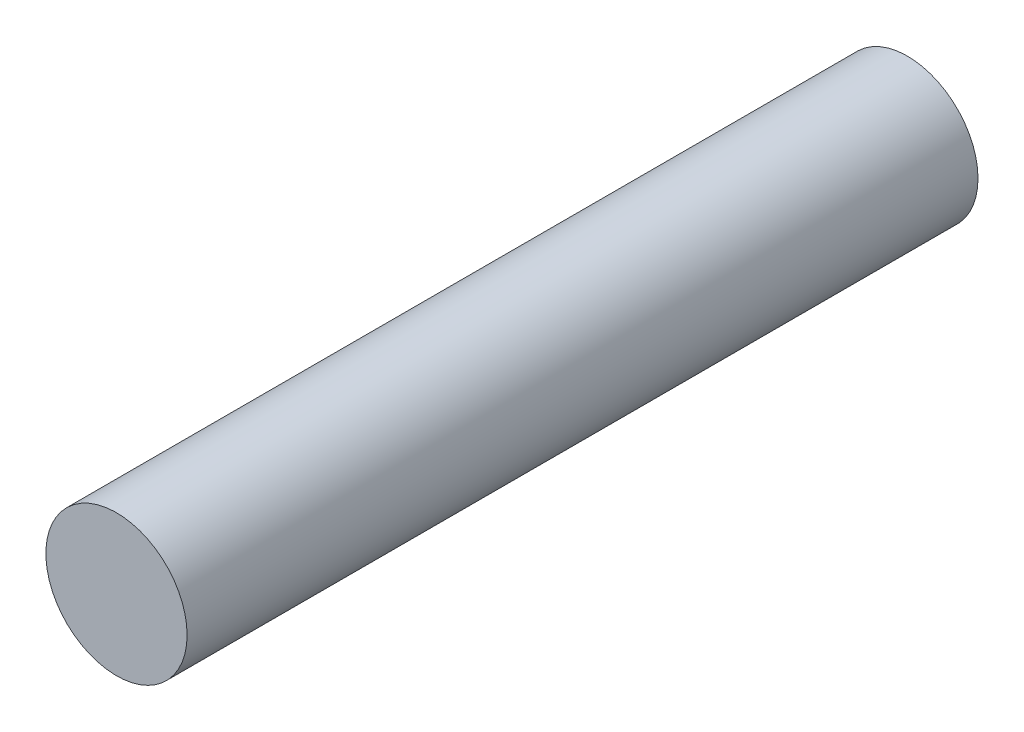
from build123d import *

# Parameters (mm, degrees)
SKETCH1_R           = 3.96875
BOSS_EXTRUDE1_DEPTH = 44.45


with BuildPart() as part:
    # Sketch1 → Boss-Extrude1 (new body)
    with BuildSketch(Plane.XY):
        Circle(SKETCH1_R)
    extrude(amount=BOSS_EXTRUDE1_DEPTH)


solid = part.part
